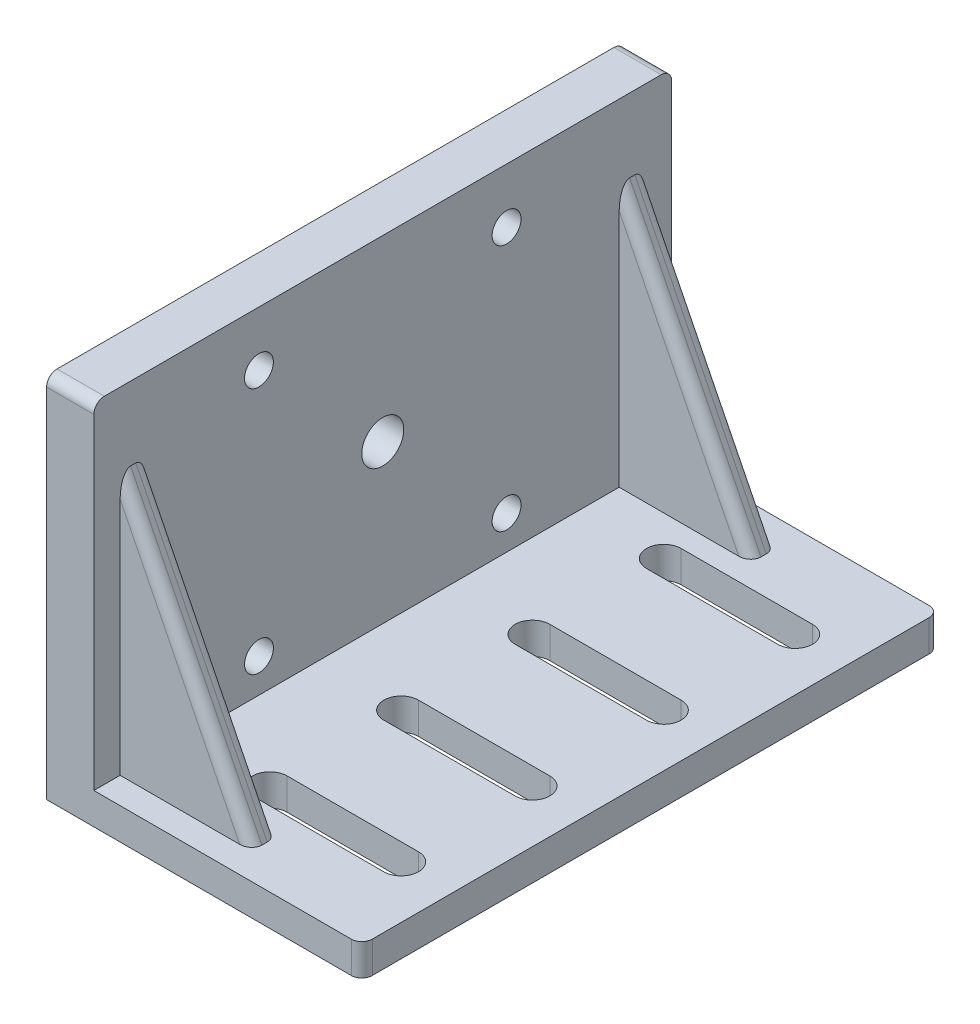
from build123d import *

# Parameters (mm, degrees)
BOSS_EXTRUDE1_DEPTH      = 110
SKETCH2_R                = 4
SKETCH2_R_2              = 2.75
CUT_EXTRUDE1_DEPTH       = 9
CUT_EXTRUDE2_DEPTH       = 6
BOSS_EXTRUDE2_DEPTH      = 3
BOSS_EXTRUDE2_DEPTH_BACK = 2
BOSS_EXTRUDE4_DEPTH      = 2
BOSS_EXTRUDE4_DEPTH_BACK = 3
FILLET1_R                = 2


with BuildPart() as part:
    # Sketch1 → Boss-Extrude1 (new body)
    with BuildSketch(Plane.XY):
        Polygon((0, 0), (60, 0), (60, 6), (9, 6), (9, 70), (0, 70), align=None)
    extrude(amount=BOSS_EXTRUDE1_DEPTH)

    # Sketch2 → Cut-Extrude1 (cut)
    with BuildSketch(Plane.ZY):
        with Locations((55, 36)):
            Circle(SKETCH2_R)
        with Locations((78.57, 59.57)):
            Circle(SKETCH2_R_2)
        with Locations((31.43, 59.57)):
            Circle(SKETCH2_R_2)
        with Locations((31.43, 12.43)):
            Circle(SKETCH2_R_2)
        with Locations((78.57, 12.43)):
            Circle(SKETCH2_R_2)
    extrude(amount=-CUT_EXTRUDE1_DEPTH, mode=Mode.SUBTRACT)

    # Sketch3 → Cut-Extrude2 (cut)
    with BuildSketch(Plane(origin=(0, 6, 0), x_dir=(1, 0, 0), z_dir=(0, 1, 0))):
        with BuildLine():
            Line((25, -14.2), (50, -14.2))
            ThreePointArc((50, -14.2), (53.3, -17.5), (50, -20.8))
            Line((50, -20.8), (25, -20.8))
            ThreePointArc((25, -20.8), (21.7, -17.5), (25, -14.2))
        make_face()
        with BuildLine():
            Line((25, -39.2), (50, -39.2))
            ThreePointArc((50, -39.2), (53.3, -42.5), (50, -45.8))
            Line((50, -45.8), (25, -45.8))
            ThreePointArc((25, -45.8), (21.7, -42.5), (25, -39.2))
        make_face()
        with BuildLine():
            Line((25, -64.2), (50, -64.2))
            ThreePointArc((50, -64.2), (53.3, -67.5), (50, -70.8))
            Line((50, -70.8), (25, -70.8))
            ThreePointArc((25, -70.8), (21.7, -67.5), (25, -64.2))
        make_face()
        with BuildLine():
            Line((25, -89.2), (50, -89.2))
            ThreePointArc((50, -89.2), (53.3, -92.5), (50, -95.8))
            Line((50, -95.8), (25, -95.8))
            ThreePointArc((25, -95.8), (21.7, -92.5), (25, -89.2))
        make_face()
    extrude(amount=-CUT_EXTRUDE2_DEPTH, mode=Mode.SUBTRACT)

    # Sketch7 → Boss-Extrude2 (add, two sides: drawn at the far end of the back side and taken through both)
    with BuildSketch(Plane.XY.offset(102).offset(-BOSS_EXTRUDE2_DEPTH_BACK)):
        Polygon((9, 56), (34, 6), (9, 6), align=None)
    extrude(amount=BOSS_EXTRUDE2_DEPTH + BOSS_EXTRUDE2_DEPTH_BACK)

    # Sketch9 → Boss-Extrude4 (add, two sides: drawn at the far end of the back side and taken through both)
    with BuildSketch(Plane.XY.offset(8).offset(-BOSS_EXTRUDE4_DEPTH_BACK)):
        Polygon((9, 56), (9, 6), (34, 6), align=None)
    extrude(amount=BOSS_EXTRUDE4_DEPTH + BOSS_EXTRUDE4_DEPTH_BACK)

    # Fillet1
    fillet1_edges = [part.edges().sort_by_distance(p)[0] for p in [
        (21.5, 31, 100),
        (21.5, 31, 105),
        (21.5, 31, 5),
        (21.5, 31, 10),
        (60, 3, 110),
        (4.5, 70, 110),
        (4.5, 70, 0),
        (60, 3, 0),
    ]]
    fillet(fillet1_edges, radius=FILLET1_R)


solid = part.part
